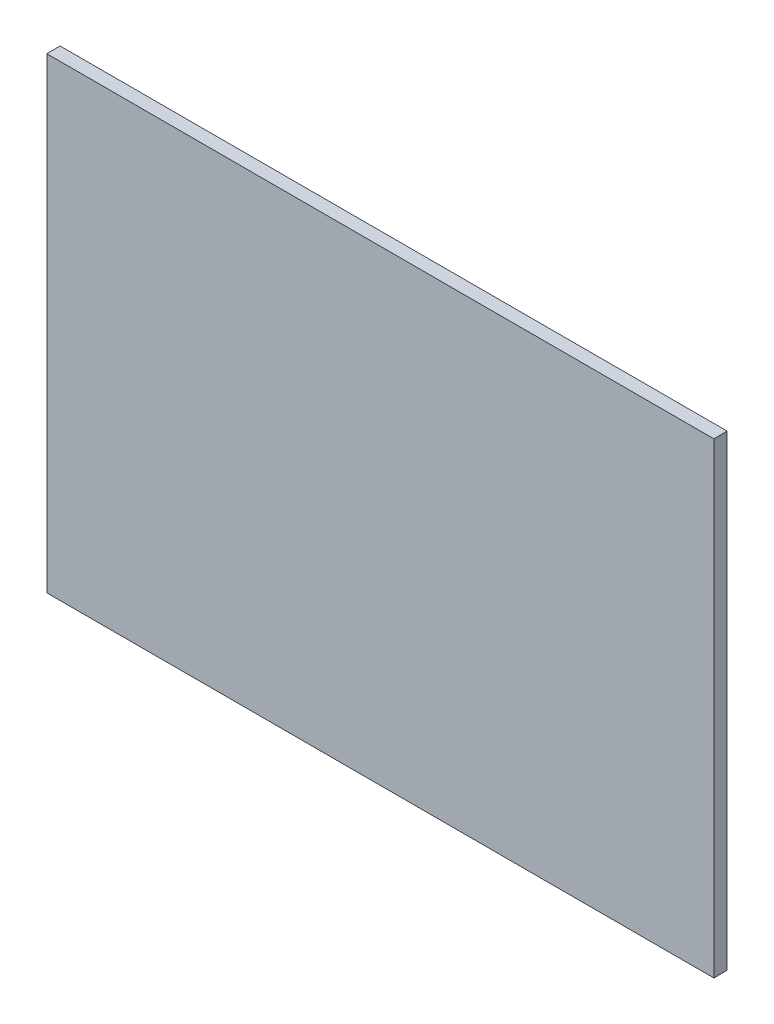
from build123d import *

# Parameters (mm, degrees)
SKETCH1_W           = 5000
SKETCH1_H           = 3500
BOSS_EXTRUDE1_DEPTH = 100


with BuildPart() as part:
    # Sketch1 → Boss-Extrude1 (new body)
    with BuildSketch(Plane.XY):
        Rectangle(SKETCH1_W, SKETCH1_H)
    extrude(amount=BOSS_EXTRUDE1_DEPTH)


solid = part.part
